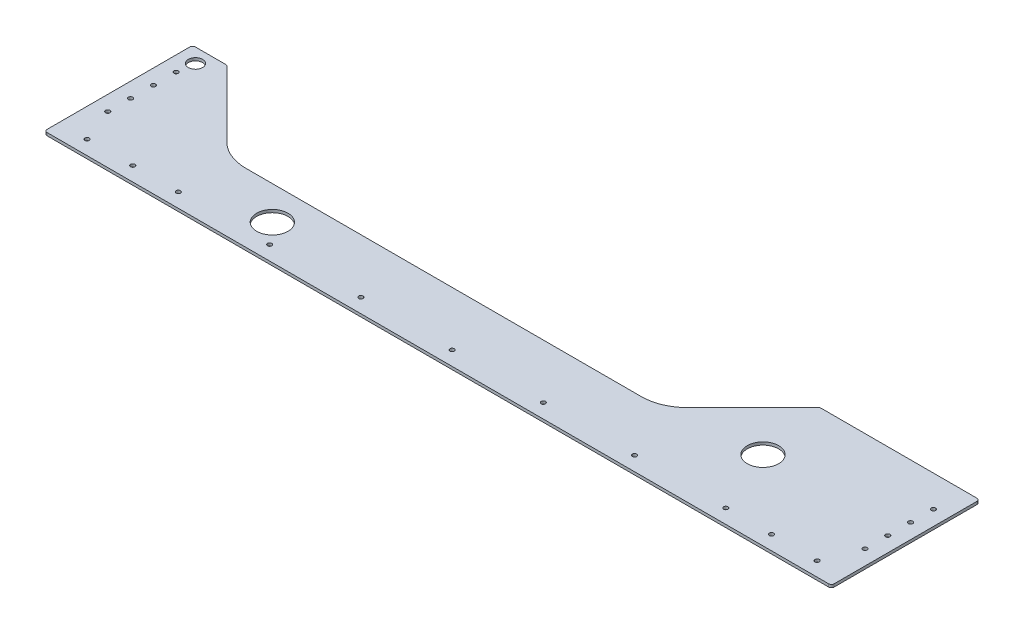
from build123d import *

# Parameters (mm, degrees)
SKETCH1_R           = 17.4625
SKETCH1_R_2         = 2.4257
SKETCH1_R_3         = 7.9375
BOSS_EXTRUDE1_DEPTH = 3.175
FILLET1_R           = 50.8
FILLET2_R           = 3.175


with BuildPart() as part:
    # Sketch1 → Boss-Extrude1 (new body)
    with BuildSketch(Plane(origin=(0, 0, 0), x_dir=(1, 0, 0), z_dir=(0, 1, 0))):
        Polygon((0, 0), (876.3, 0), (876.3, 165.1), (698.5, 165.1), (609.6, 76.2), (127, 76.2), (38.1, 165.1), (0, 165.1), align=None)
        with Locations(Location((214.9475, 38.9255, 0), (0, 0, 270))):
            Circle(SKETCH1_R, mode=Mode.SUBTRACT)
        with Locations(Location((712.16774, 87.9475, 0), (0, 0, 270))):
            Circle(SKETCH1_R, mode=Mode.SUBTRACT)
        with Locations(Location((438.15, 15.875, 0), (0, 0, 270))):
            Circle(SKETCH1_R_2, mode=Mode.SUBTRACT)
        with Locations(Location((539.75, 15.875, 0), (0, 0, 270))):
            Circle(SKETCH1_R_2, mode=Mode.SUBTRACT)
        with Locations(Location((641.35, 15.875, 0), (0, 0, 270))):
            Circle(SKETCH1_R_2, mode=Mode.SUBTRACT)
        with Locations(Location((742.95, 15.875, 0), (0, 0, 270))):
            Circle(SKETCH1_R_2, mode=Mode.SUBTRACT)
        with Locations(Location((844.55, 15.875, 0), (0, 0, 270))):
            Circle(SKETCH1_R_2, mode=Mode.SUBTRACT)
        with Locations(Location((31.75, 15.875, 0), (0, 0, 270))):
            Circle(SKETCH1_R_2, mode=Mode.SUBTRACT)
        with Locations(Location((133.35, 15.875, 0), (0, 0, 270))):
            Circle(SKETCH1_R_2, mode=Mode.SUBTRACT)
        with Locations(Location((234.95, 15.875, 0), (0, 0, 270))):
            Circle(SKETCH1_R_2, mode=Mode.SUBTRACT)
        with Locations(Location((336.55, 15.875, 0), (0, 0, 270))):
            Circle(SKETCH1_R_2, mode=Mode.SUBTRACT)
        with Locations(Location((16.637, 53.975, 0), (0, 0, 270))):
            Circle(SKETCH1_R_2, mode=Mode.SUBTRACT)
        with Locations(Location((16.637, 79.375, 0), (0, 0, 270))):
            Circle(SKETCH1_R_2, mode=Mode.SUBTRACT)
        with Locations(Location((16.637, 104.775, 0), (0, 0, 270))):
            Circle(SKETCH1_R_2, mode=Mode.SUBTRACT)
        with Locations(Location((16.637, 130.175, 0), (0, 0, 270))):
            Circle(SKETCH1_R_2, mode=Mode.SUBTRACT)
        with Locations(Location((859.663, 53.975, 0), (0, 0, 270))):
            Circle(SKETCH1_R_2, mode=Mode.SUBTRACT)
        with Locations(Location((859.663, 79.375, 0), (0, 0, 270))):
            Circle(SKETCH1_R_2, mode=Mode.SUBTRACT)
        with Locations(Location((859.663, 104.775, 0), (0, 0, 270))):
            Circle(SKETCH1_R_2, mode=Mode.SUBTRACT)
        with Locations(Location((859.663, 130.175, 0), (0, 0, 270))):
            Circle(SKETCH1_R_2, mode=Mode.SUBTRACT)
        with Locations(Location((82.55, 15.875, 0), (0, 0, 270))):
            Circle(SKETCH1_R_2, mode=Mode.SUBTRACT)
        with Locations(Location((793.75, 15.875, 0), (0, 0, 270))):
            Circle(SKETCH1_R_2, mode=Mode.SUBTRACT)
        with Locations(Location((19.05, 149.225, 0), (0, 0, 270))):
            Circle(SKETCH1_R_3, mode=Mode.SUBTRACT)
    extrude(amount=BOSS_EXTRUDE1_DEPTH)

    # Fillet1
    fillet1_edges = [part.edges().sort_by_distance(p)[0] for p in [
        (127, 1.5875, -76.2),
        (609.6, 1.5875, -76.2),
    ]]
    fillet(fillet1_edges, radius=FILLET1_R)

    # Fillet2
    fillet2_edges = [part.edges().sort_by_distance(p)[0] for p in [
        (698.5, 1.5875, -165.1),
        (876.3, 1.5875, -165.1),
        (876.3, 1.5875, 0),
        (0, 1.5875, 0),
        (0, 1.5875, -165.1),
        (38.1, 1.5875, -165.1),
    ]]
    fillet(fillet2_edges, radius=FILLET2_R)


solid = part.part
